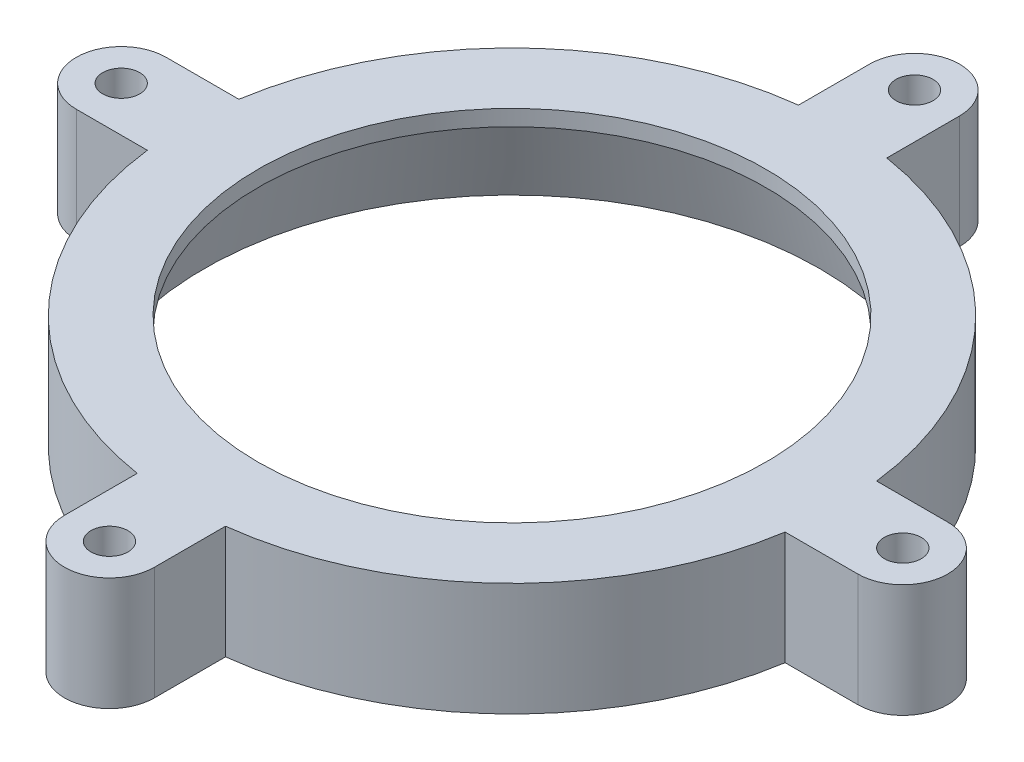
from build123d import *

# Parameters (mm, degrees)
SKETCH1_R           = 62
SKETCH1_R_2         = 58.2
BOSS_EXTRUDE1_DEPTH = 18.4
BOSS_EXTRUDE1_DRAFT = -15
SKETCH2_R           = 82
SKETCH2_R_2         = 62
CUT_EXTRUDE1_DEPTH  = 97.425519359
SKETCH3_R           = 62
SKETCH3_R_2         = 48
BOSS_EXTRUDE2_DEPTH = 3
SKETCH4_R           = 2.125
BOSS_EXTRUDE3_DEPTH = 21.4
CIRPATTERN1_COUNT   = 4
SKETCH5_R           = 3.5
CUT_EXTRUDE2_DEPTH  = 9.4


with BuildPart() as part:
    # Sketch1 → Boss-Extrude1 (with draft: the straight prism first)
    with BuildSketch(Plane(origin=(0, 0, 0), x_dir=(1, 0, 0), z_dir=(0, 1, 0))):
        Circle(SKETCH1_R)
        Circle(SKETCH1_R_2, mode=Mode.SUBTRACT)
    extrude(amount=BOSS_EXTRUDE1_DEPTH)
    # Boss-Extrude1: the draft: its side faces are tilted about the plane it starts from
    boss_extrude1_sides = [part.faces().sort_by_distance(p)[0] for p in [
        (-62, 9.2, 0),
        (-58.2, 9.2, 0),
    ]]
    draft(boss_extrude1_sides, Plane(origin=(0, 0, 0), x_dir=(1, 0, 0), z_dir=(0, 1, 0)), BOSS_EXTRUDE1_DRAFT)

    # Sketch2 → Cut-Extrude1 (cut, through all)
    with BuildSketch(Plane.XZ):
        Circle(SKETCH2_R)
        with Locations(Location((0, 0, 0), (0, 0, 270))):
            Circle(SKETCH2_R_2, mode=Mode.SUBTRACT)
    extrude(amount=-CUT_EXTRUDE1_DEPTH, mode=Mode.SUBTRACT)

    # Sketch3 → Boss-Extrude2 (add)
    with BuildSketch(Plane(origin=(0, 18.4, 0), x_dir=(1, 0, 0), z_dir=(0, 1, 0))):
        with Locations(Location((0, 0, 0), (0, 0, 90))):
            Circle(SKETCH3_R)
        with Locations(Location((0, 0, 0), (0, 0, 270))):
            Circle(SKETCH3_R_2, mode=Mode.SUBTRACT)
    extrude(amount=BOSS_EXTRUDE2_DEPTH)

    # Sketch4 → Boss-Extrude3 (add)
    with BuildSketch(Plane(origin=(0, 21.4, 0), x_dir=(1, 0, 0), z_dir=(0, 1, 0))):
        with BuildLine():
            Line((-75, 9.610336935), (-58.480915803, 9.610336935))
            Line((-58.480915803, 9.610336935), (-58.480915803, -7.389663065))
            Line((-58.480915803, -7.389663065), (-75, -7.389663065))
            ThreePointArc((-75, -7.389663065), (-83.5, 1.110336935), (-75, 9.610336935))
        make_face()
        with Locations(Location((-75, 1.110336935, 0), (0, 0, 270))):
            Circle(SKETCH4_R, mode=Mode.SUBTRACT)
    boss_extrude3 = extrude(amount=-BOSS_EXTRUDE3_DEPTH)

    # CirPattern1: Boss-Extrude3 ×4 about axis
    cirpattern1_axis = Axis((0, 0, 0), (0, 1, 0))
    for i in range(1, CIRPATTERN1_COUNT):
        add(boss_extrude3.rotate(cirpattern1_axis, i * 360 / CIRPATTERN1_COUNT))

    # Sketch5 → Cut-Extrude2 (cut)
    with BuildSketch(Plane(origin=(0, 21.4, 0), x_dir=(1, 0, 0), z_dir=(0, 1, 0))):
        with Locations(Location((-75, 1.110336935, 0), (0, 0, 270))):
            Circle(SKETCH5_R)
        with Locations(Location((1.110336935, 75, 0), (0, 0, 270))):
            Circle(SKETCH5_R)
        with Locations(Location((75, -1.110336935, 0), (0, 0, 270))):
            Circle(SKETCH5_R)
        with Locations(Location((-1.110336935, -75, 0), (0, 0, 270))):
            Circle(SKETCH5_R)
    extrude(amount=-CUT_EXTRUDE2_DEPTH, mode=Mode.SUBTRACT)


solid = part.part
